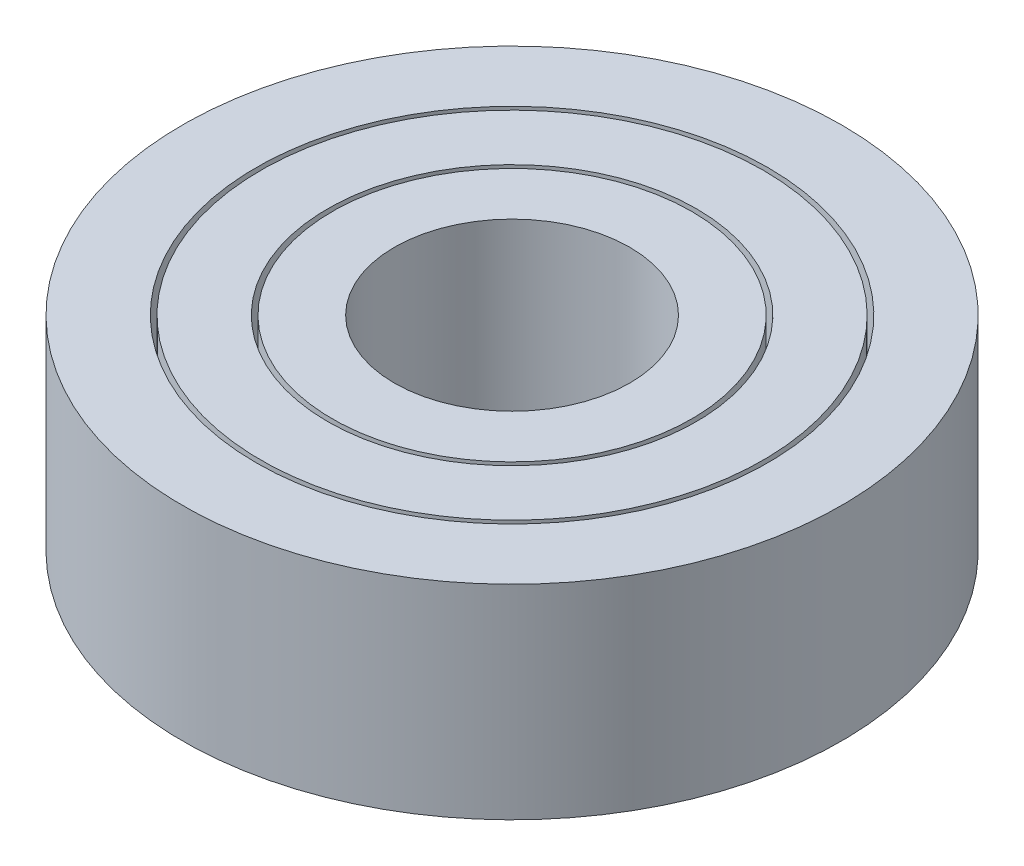
from build123d import *

# Parameters (mm, degrees)
SKETCH1_R           = 21
SKETCH1_R_2         = 16.3
BOSS_EXTRUDE1_DEPTH = 13
SKETCH2_R           = 16
SKETCH2_R_2         = 11.75
BOSS_EXTRUDE2_DEPTH = 13
SKETCH3_R           = 11.45
SKETCH3_R_2         = 7.5
BOSS_EXTRUDE4_DEPTH = 13


with BuildPart() as part:
    # Sketch1 → Boss-Extrude1 (new body)
    with BuildSketch(Plane(origin=(0, 0, 0), x_dir=(1, 0, 0), z_dir=(0, 1, 0))):
        with Locations(Location((0, 0, 0), (0, 0, 90))):
            Circle(SKETCH1_R)
        with Locations(Location((0, 0, 0), (0, 0, 90))):
            Circle(SKETCH1_R_2, mode=Mode.SUBTRACT)
    extrude(amount=BOSS_EXTRUDE1_DEPTH)


with BuildPart() as body_2:
    # Sketch2 → Boss-Extrude2 (new body)
    with BuildSketch(Plane(origin=(0, 0, 0), x_dir=(1, 0, 0), z_dir=(0, 1, 0))):
        with Locations(Location((0, 0, 0), (0, 0, 90))):
            Circle(SKETCH2_R)
        with Locations(Location((0, 0, 0), (0, 0, 90))):
            Circle(SKETCH2_R_2, mode=Mode.SUBTRACT)
    extrude(amount=BOSS_EXTRUDE2_DEPTH)


with BuildPart() as body_3:
    # Sketch3 → Boss-Extrude4 (new body)
    with BuildSketch(Plane(origin=(0, 0, 0), x_dir=(1, 0, 0), z_dir=(0, 1, 0))):
        with Locations(Location((0, 0, 0), (0, 0, 90))):
            Circle(SKETCH3_R)
        with Locations(Location((0, 0, 0), (0, 0, 90))):
            Circle(SKETCH3_R_2, mode=Mode.SUBTRACT)
    extrude(amount=BOSS_EXTRUDE4_DEPTH)


solid = Compound([part.part, body_2.part, body_3.part])
